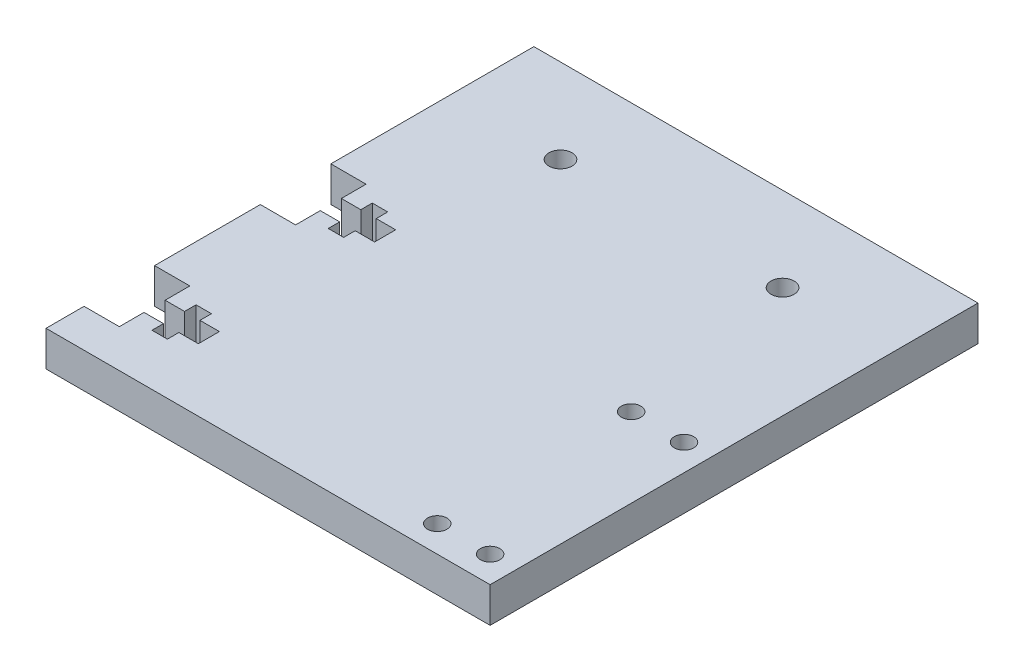
from build123d import *

# Parameters (mm, degrees)
SKETCH1_W             = 80
SKETCH1_H             = 87.884
BOSS_EXTRUDE1_DEPTH   = 3.175
F_6_CLEARANCE_HOLE1_D = 3.5052
LPATTERN1_COUNT       = 2
LPATTERN1_PITCH       = 9.525
LPATTERN1_COUNT_DIR2  = 2
LPATTERN1_PITCH_DIR2  = 34.925
CUT_EXTRUDE1_REACH    = 61.76
LPATTERN3_COUNT       = 2
LPATTERN3_PITCH       = 31.75
SKETCH10_R            = 2.0828
CUT_EXTRUDE2_DEPTH    = 60.759701003


with BuildPart() as part:
    # Sketch1 → Boss-Extrude1 (new, symmetric)
    with BuildSketch(Plane(origin=(0, 0, 0), x_dir=(1, 0, 0), z_dir=(0, 1, 0))):
        Rectangle(SKETCH1_W, SKETCH1_H)
    extrude(amount=BOSS_EXTRUDE1_DEPTH, both=True)

    # #6 Clearance Hole1 (through all)
    with Locations(Plane(origin=(0, 3.175, 0), x_dir=(1, 0, 0), z_dir=(0, 1, 0))):
        with Locations((35.2375, -39.1795)):
            f_6_clearance_hole1 = Hole(F_6_CLEARANCE_HOLE1_D / 2)

    # LPattern1: 6 Clearance Hole1 2 × 2
    with Locations(*[(-i * LPATTERN1_PITCH, 0, -j * LPATTERN1_PITCH_DIR2) for i in range(LPATTERN1_COUNT) for j in range(LPATTERN1_COUNT_DIR2) if (i, j) != (0, 0)]):
        add(f_6_clearance_hole1, mode=Mode.SUBTRACT)

    # Sketch7 → Cut-Extrude1 (cut, up to next)
    with BuildSketch(Plane(origin=(0, 3.175, 0), x_dir=(1, 0, 0), z_dir=(0, 1, 0)), mode=Mode.PRIVATE) as cut_extrude1_sk1:
        Polygon((-40, 7.366), (-40, -5.334), (-33.65, -5.334), (-33.65, -0.88265), (-30.1495625, -0.88265), (-30.1495625, -2.95275), (-27.3714375, -2.95275), (-27.3714375, -0.88265), (-23.871, -0.88265), (-23.871, 2.91465), (-27.3714375, 2.91465), (-27.3714375, 4.98475), (-30.1495625, 4.98475), (-30.1495625, 2.91465), (-33.65, 2.91465), (-33.65, 7.366), align=None)
    cut_extrude1_tool1 = extrude(cut_extrude1_sk1.sketch, amount=-CUT_EXTRUDE1_REACH, mode=Mode.PRIVATE) & part.part
    cut_extrude1 = cut_extrude1_tool1.solids().sort_by_distance((-33.791113, 3.175, -1.016))[0]
    add(cut_extrude1, mode=Mode.SUBTRACT)

    # LPattern3: Cut-Extrude1 ×2
    with Locations(*[(0, 0, i * LPATTERN3_PITCH) for i in range(1, LPATTERN3_COUNT)]):
        add(cut_extrude1, mode=Mode.SUBTRACT)

    # Sketch10 → Cut-Extrude2 (cut, through all)
    with BuildSketch(Plane(origin=(0, 3.175, 0), x_dir=(1, 0, 0), z_dir=(0, 1, 0))):
        with Locations(Location((20, 28.733, 0), (0, 0, 270))):
            Circle(SKETCH10_R)
        with Locations(Location((-20, 28.733, 0), (0, 0, 270))):
            Circle(SKETCH10_R)
    extrude(amount=-CUT_EXTRUDE2_DEPTH, mode=Mode.SUBTRACT)


solid = part.part
